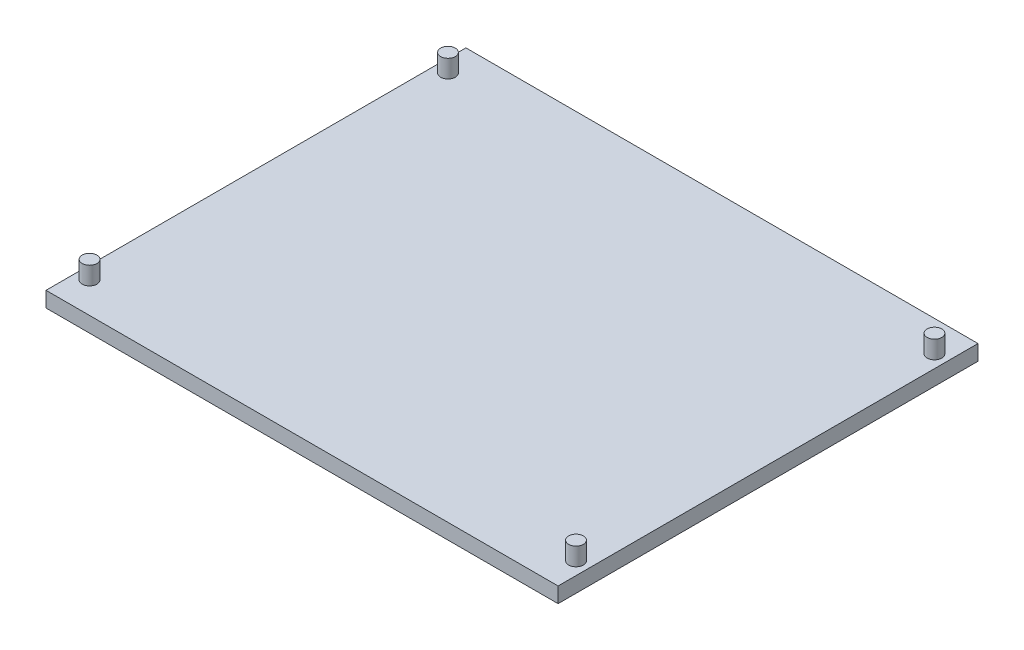
from build123d import *

# Parameters (mm, degrees)
SKETCH1_W           = 100
SKETCH1_H           = 82
BOSS_EXTRUDE1_DEPTH = 3
SKETCH4_R           = 1.435
BOSS_EXTRUDE2_DEPTH = 3.5


with BuildPart() as part:
    # Sketch1 → Boss-Extrude1 (new body)
    with BuildSketch(Plane(origin=(0, 0, 0), x_dir=(1, 0, 0), z_dir=(0, 1, 0))):
        Rectangle(SKETCH1_W, SKETCH1_H)
    extrude(amount=BOSS_EXTRUDE1_DEPTH)

    # Sketch4 → Boss-Extrude2 (add)
    with BuildSketch(Plane(origin=(0, 3, 0), x_dir=(1, 0, 0), z_dir=(0, 1, 0))):
        with Locations(Location((-47.5, 35, 0), (0, 0, 90))):
            Circle(SKETCH4_R)
        with Locations(Location((47.5, 35, 0), (0, 0, 90))):
            Circle(SKETCH4_R)
        with Locations(Location((47.5, -35, 0), (0, 0, 90))):
            Circle(SKETCH4_R)
        with Locations(Location((-47.5, -35, 0), (0, 0, 90))):
            Circle(SKETCH4_R)
    extrude(amount=BOSS_EXTRUDE2_DEPTH)


solid = part.part
